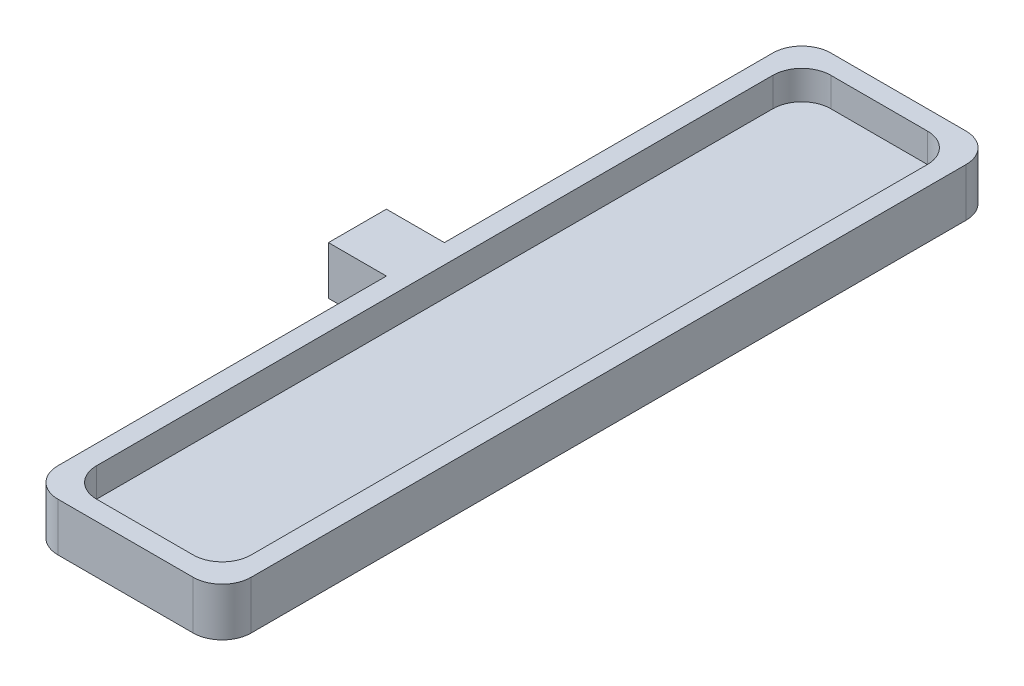
from build123d import *

# Parameters (mm, degrees)
SKETCH1_W           = 20
SKETCH1_H           = 80
BOSS_EXTRUDE1_DEPTH = 5
SHELL1_T            = -2
FILLET1_R           = 3
FILLET2_R           = 3
FILLET3_R           = 3
FILLET4_R           = 3
FILLET5_R           = 3
FILLET6_R           = 3
FILLET7_R           = 3
FILLET8_R           = 3
SKETCH2_W           = 6
SKETCH2_H           = 5
BOSS_EXTRUDE2_DEPTH = 6
SKETCH3_R           = 1.425
CUT_EXTRUDE1_DEPTH  = 4


with BuildPart() as part:
    # Sketch1 → Boss-Extrude1 (new body)
    with BuildSketch(Plane(origin=(0, 0, 0), x_dir=(1, 0, 0), z_dir=(0, 1, 0))):
        with Locations((10, 40)):
            Rectangle(SKETCH1_W, SKETCH1_H)
    extrude(amount=BOSS_EXTRUDE1_DEPTH)

    # Shell1
    shell1_openings = [part.faces().sort_by_distance(p)[0] for p in [
        (10, 5, -40),
    ]]
    offset(amount=SHELL1_T, openings=shell1_openings, kind=Kind.INTERSECTION)

    # Fillet1
    fillet1_edges = [part.edges().sort_by_distance(p)[0] for p in [
        (20, 2.5, 0),
    ]]
    fillet(fillet1_edges, radius=FILLET1_R)

    # Fillet2
    fillet2_edges = [part.edges().sort_by_distance(p)[0] for p in [
        (0, 2.5, 0),
    ]]
    fillet(fillet2_edges, radius=FILLET2_R)

    # Fillet3
    fillet3_edges = [part.edges().sort_by_distance(p)[0] for p in [
        (20, 2.5, -80),
    ]]
    fillet(fillet3_edges, radius=FILLET3_R)

    # Fillet4
    fillet4_edges = [part.edges().sort_by_distance(p)[0] for p in [
        (0, 2.5, -80),
    ]]
    fillet(fillet4_edges, radius=FILLET4_R)

    # Fillet5
    fillet5_edges = [part.edges().sort_by_distance(p)[0] for p in [
        (2, 3.5, -2),
    ]]
    fillet(fillet5_edges, radius=FILLET5_R)

    # Fillet6
    fillet6_edges = [part.edges().sort_by_distance(p)[0] for p in [
        (18, 3.5, -2),
    ]]
    fillet(fillet6_edges, radius=FILLET6_R)

    # Fillet7
    fillet7_edges = [part.edges().sort_by_distance(p)[0] for p in [
        (2, 3.5, -78),
    ]]
    fillet(fillet7_edges, radius=FILLET7_R)

    # Fillet8
    fillet8_edges = [part.edges().sort_by_distance(p)[0] for p in [
        (18, 3.5, -78),
    ]]
    fillet(fillet8_edges, radius=FILLET8_R)

    # Sketch2 → Boss-Extrude2 (add)
    with BuildSketch(Plane.ZY):
        with Locations((-40, 2.5)):
            Rectangle(SKETCH2_W, SKETCH2_H)
    extrude(amount=BOSS_EXTRUDE2_DEPTH)

    # Sketch3 → Cut-Extrude1 (cut)
    with BuildSketch(Plane.ZY.offset(6)):
        with Locations((-40, 2.5)):
            Circle(SKETCH3_R)
    extrude(amount=-CUT_EXTRUDE1_DEPTH, mode=Mode.SUBTRACT)


solid = part.part
